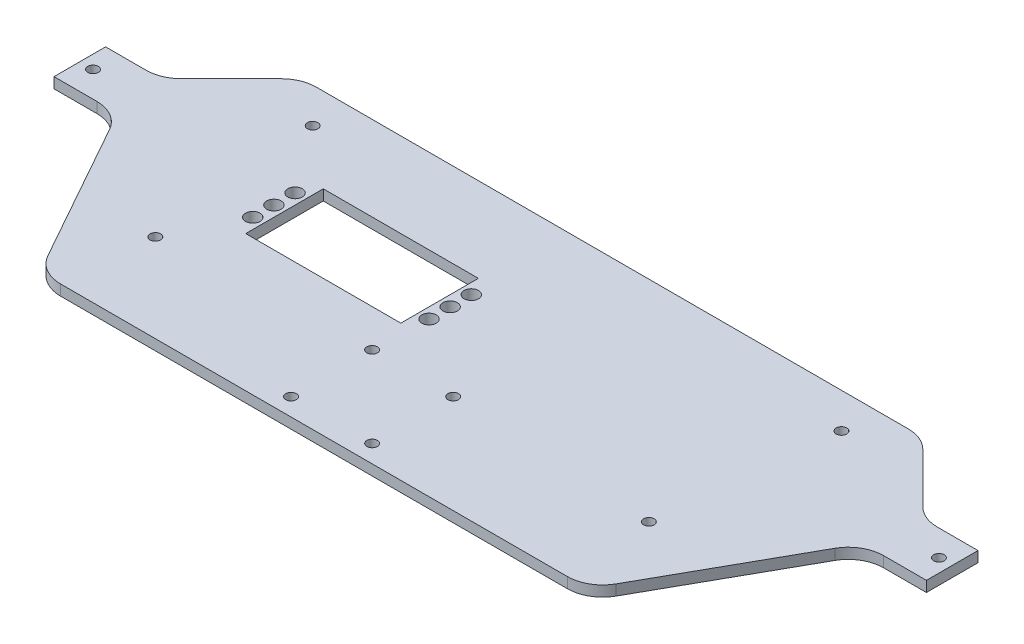
from build123d import *

# Parameters (mm, degrees)
SALIENTE_EXTRUIR1_DEPTH = 3
REDONDEO1_R             = 10
CROQUIS2_R              = 1.5
CROQUIS2_R_2            = 2.05
CROQUIS2_W              = 42
CROQUIS2_H              = 20
CORTAR_EXTRUIR1_DEPTH   = 135.610141171
CROQUIS3_W              = 4
CROQUIS3_H              = 14.636342218
CORTAR_EXTRUIR2_DEPTH   = 135.610141171
CROQUIS4_W              = 44
CROQUIS4_H              = 22
CORTAR_EXTRUIR3_DEPTH   = 131.820067673


with BuildPart() as part:
    # Croquis1 → Saliente-Extruir1 (new body)
    with BuildSketch(Plane(origin=(0, 0, 0), x_dir=(1, 0, 0), z_dir=(0, 1, 0))):
        Polygon((-88.1, 42.318171109), (88.1, 42.318171109), (108.1, 22.318171109), (127.75, 22.318171109), (127.75, 7.681828891), (105.75, 7.681828891), (77.75, -42.318171109), (-77.75, -42.318171109), (-105.75, 7.681828891), (-127.75, 7.681828891), (-127.75, 22.318171109), (-108.1, 22.318171109), align=None)
    extrude(amount=SALIENTE_EXTRUIR1_DEPTH)

    # Redondeo1
    redondeo1_edges = [part.edges().sort_by_distance(p)[0] for p in [
        (-88.1, 1.5, -42.318171109),
        (88.1, 1.5, -42.318171109),
        (108.1, 1.5, -22.318171109),
        (105.75, 1.5, -7.681828891),
        (77.75, 1.5, 42.318171109),
        (-77.75, 1.5, 42.318171109),
        (-105.75, 1.5, -7.681828891),
        (-108.1, 1.5, -22.318171109),
    ]]
    fillet(redondeo1_edges, radius=REDONDEO1_R)

    # Croquis2 → Cortar-Extruir1 (cut, through all)
    with BuildSketch(Plane(origin=(0, 3, 0), x_dir=(1, 0, 0), z_dir=(0, 1, 0))):
        with Locations(Location((70, -17.318171109, 0), (0, 0, 270))):
            Circle(CROQUIS2_R)
        with Locations(Location((-70, -17.318171109, 0), (0, 0, 270))):
            Circle(CROQUIS2_R)
        with Locations(Location((-119.996067812, 15, 0), (0, 0, 270))):
            Circle(CROQUIS2_R)
        with Locations(Location((119.996067812, 15, 0), (0, 0, 270))):
            Circle(CROQUIS2_R)
        with Locations(Location((-75, 32.318171109, 0), (0, 0, 270))):
            Circle(CROQUIS2_R)
        with Locations(Location((75, 32.318171109, 0), (0, 0, 270))):
            Circle(CROQUIS2_R)
        with Locations(Location((-11.5, -14.318171109, 0), (0, 0, 270))):
            Circle(CROQUIS2_R)
        with Locations(Location((11.5, -14.318171109, 0), (0, 0, 270))):
            Circle(CROQUIS2_R)
        with Locations(Location((-11.5, -37.318171109, 0), (0, 0, 270))):
            Circle(CROQUIS2_R)
        with Locations(Location((11.5, -37.318171109, 0), (0, 0, 270))):
            Circle(CROQUIS2_R)
        with Locations(Location((-61, 7.318171109, 0), (0, 0, 270))):
            Circle(CROQUIS2_R_2)
        with Locations(Location((-11, 7.318171109, 0), (0, 0, 270))):
            Circle(CROQUIS2_R_2)
        with Locations(Location((-61, 13.318171109, 0), (0, 0, 270))):
            Circle(CROQUIS2_R_2)
        with Locations(Location((-61, 1.318171109, 0), (0, 0, 270))):
            Circle(CROQUIS2_R_2)
        with Locations(Location((-11, 13.318171109, 0), (0, 0, 270))):
            Circle(CROQUIS2_R_2)
        with Locations(Location((-11, 1.318171109, 0), (0, 0, 270))):
            Circle(CROQUIS2_R_2)
        with Locations((-36, 7.318171109)):
            Rectangle(CROQUIS2_W, CROQUIS2_H)
    extrude(amount=-CORTAR_EXTRUIR1_DEPTH, mode=Mode.SUBTRACT)

    # Croquis3 → Cortar-Extruir2 (cut, through all)
    with BuildSketch(Plane(origin=(0, 3, 0), x_dir=(1, 0, 0), z_dir=(0, 1, 0))):
        with Locations((-125.75, 15)):
            Rectangle(CROQUIS3_W, CROQUIS3_H)
        with Locations((125.75, 15)):
            Rectangle(CROQUIS3_W, CROQUIS3_H)
    extrude(amount=-CORTAR_EXTRUIR2_DEPTH, mode=Mode.SUBTRACT)

    # Croquis4 → Cortar-Extruir3 (cut, through all)
    with BuildSketch(Plane(origin=(0, 3, 0), x_dir=(1, 0, 0), z_dir=(0, 1, 0))):
        with Locations((-36, 7.318171109)):
            Rectangle(CROQUIS4_W, CROQUIS4_H)
    extrude(amount=-CORTAR_EXTRUIR3_DEPTH, mode=Mode.SUBTRACT)


solid = part.part
